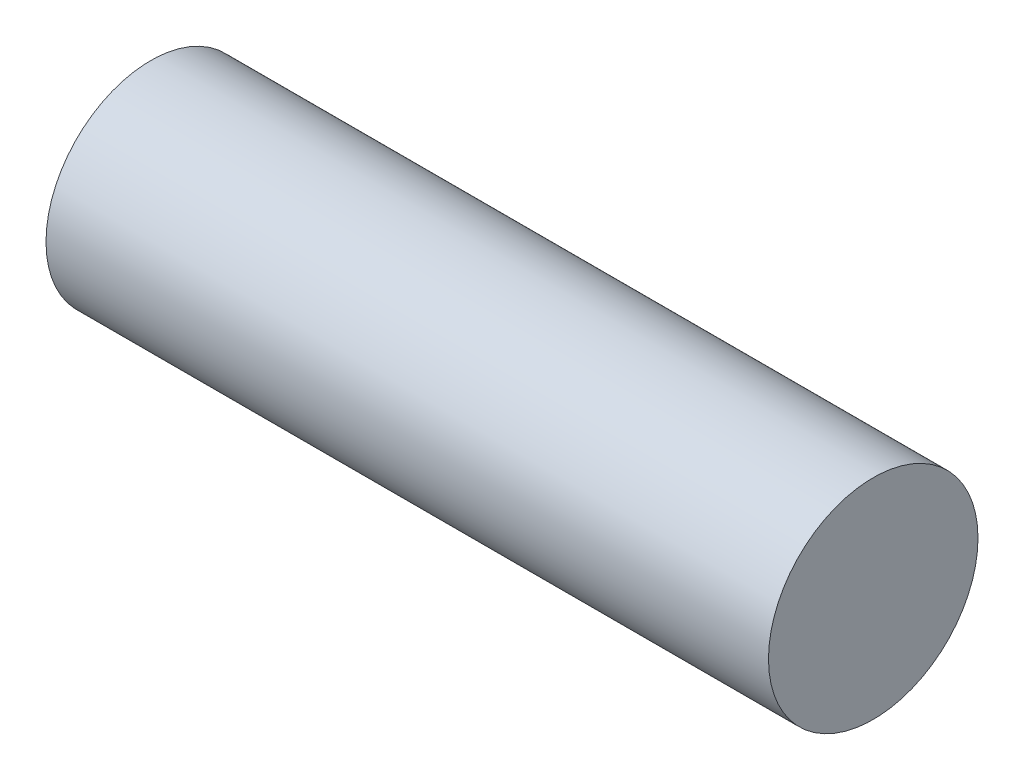
from build123d import *

# Parameters (mm, degrees)
SKETCH1_R           = 7.25
BOSS_EXTRUDE1_DEPTH = 25


with BuildPart() as part:
    # Sketch1 → Boss-Extrude1 (new, symmetric)
    with BuildSketch(Plane(origin=(0, 0, 0), x_dir=(0, 0, -1), z_dir=(1, 0, 0))):
        Circle(SKETCH1_R)
    extrude(amount=BOSS_EXTRUDE1_DEPTH, both=True)


solid = part.part
